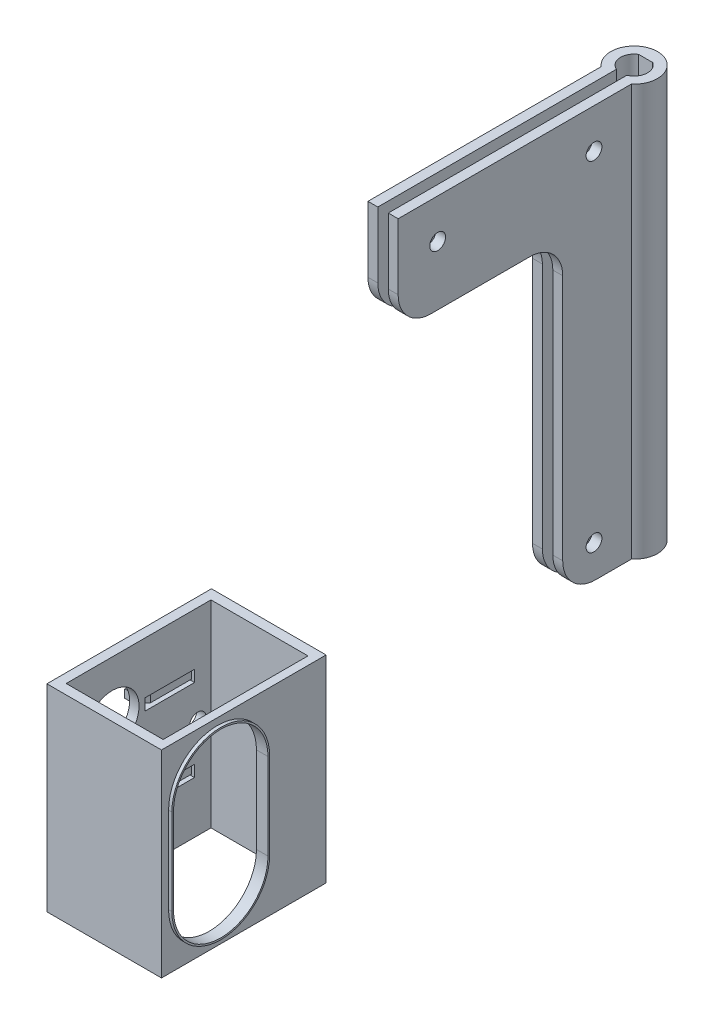
from build123d import *

# Parameters (mm, degrees)
BOSS_EXTRUDE1_DEPTH  = 125
SKETCH6_W            = 3
SKETCH6_H            = 50
BOSS_EXTRUDE3_DEPTH  = 30
FILLET6_R            = 10
M4_CLEARANCE_HOLE1_D = 4.8
SKETCH16_W           = 50
SKETCH16_H           = 60
SKETCH16_R           = 8.15
BOSS_EXTRUDE9_DEPTH  = 2.85
SKETCH19_W           = 2.5
SKETCH19_H           = 60
BOSS_EXTRUDE11_DEPTH = 31.975
SKETCH20_W           = 2.5
SKETCH20_H           = 50
BOSS_EXTRUDE12_DEPTH = 60
CUT_EXTRUDE3_DEPTH   = 2.5
BOSS_EXTRUDE13_DEPTH = 1
BOSS_EXTRUDE10_START = -60
SKETCH18_W           = 34.825
SKETCH18_H           = 3
BOSS_EXTRUDE10_DEPTH = 60
CUT_EXTRUDE4_DEPTH   = 2.85
BOSS_EXTRUDE16_DEPTH = 2.5
SKETCH26_W           = 15
SKETCH26_H           = 3.5
CUT_EXTRUDE5_DEPTH   = 0.85
CHAMFER4_SIZE        = 2
SKETCH27_R           = 2.5
CUT_EXTRUDE6_DEPTH   = 2.85
SKETCH28_R           = 2.5
CUT_EXTRUDE7_DEPTH   = 3


with BuildPart() as part:
    # Sketch1 → Boss-Extrude1 (new body)
    with BuildSketch(Plane(origin=(0, 0, 0), x_dir=(1, 0, 0), z_dir=(0, 1, 0))):
        with BuildLine():
            Line((-1.5875, -3.780190967), (-1.5875, -26.280190967))
            Line((-1.5875, -26.280190967), (-4.5875, -26.280190967))
            Line((-4.5875, -26.280190967), (-4.5875, -5.41893382))
            ThreePointArc((-4.5875, -5.41893382), (0, 7.1), (4.5875, -5.41893382))
            Line((4.5875, -5.41893382), (4.5875, -26.280190967))
            Line((4.5875, -26.280190967), (1.5875, -26.280190967))
            Line((1.5875, -26.280190967), (1.5875, -3.780190967))
            ThreePointArc((1.5875, -3.780190967), (4.088437399, -0.30770056), (2.13541565, 3.5))
            Line((2.13541565, 3.5), (-2.13541565, 3.5))
            ThreePointArc((-2.13541565, 3.5), (-4.088437399, -0.30770056), (-1.5875, -3.780190967))
        make_face()
    extrude(amount=BOSS_EXTRUDE1_DEPTH)

    # Sketch6 → Boss-Extrude3 (add)
    with BuildSketch(Plane(origin=(0, 125, 0), x_dir=(1, 0, 0), z_dir=(0, 1, 0))):
        with Locations((3.0875, -51.280190967)):
            Rectangle(SKETCH6_W, SKETCH6_H)
        with Locations((-3.0875, -51.280190967)):
            Rectangle(SKETCH6_W, SKETCH6_H)
    extrude(amount=-BOSS_EXTRUDE3_DEPTH)

    # Fillet6
    fillet6_edges = [part.edges().sort_by_distance(p)[0] for p in [
        (-3.0875, 0, 26.280190967),
        (3.0875, 0, 26.280190967),
        (3.0875, 95, 26.280190967),
        (3.0875, 95, 76.280190967),
        (-3.0875, 95, 26.280190967),
        (-3.0875, 95, 76.280190967),
    ]]
    fillet(fillet6_edges, radius=FILLET6_R)

    # M4 Clearance Hole1 (through all)
    with Locations(Plane(origin=(4.5875, 0, 0), x_dir=(0, 0, -1), z_dir=(1, 0, 0))):
        with Locations((-16.780190967, 113), (-16.780190967, 10), (-64.280190967, 113)):
            Hole(M4_CLEARANCE_HOLE1_D / 2)


with BuildPart() as body_2:
    # Sketch16 → Boss-Extrude9 (new body)
    with BuildSketch(Plane.ZY.offset(36.4125)):
        with Locations((117, -15)):
            Rectangle(SKETCH16_W, SKETCH16_H)
        with Locations((125, -2)):
            Circle(SKETCH16_R, mode=Mode.SUBTRACT)
        with Locations((125, -28)):
            Circle(SKETCH16_R, mode=Mode.SUBTRACT)
        with BuildLine():
            Line((134.9, -11), (134.9, -19))
            ThreePointArc((134.9, -19), (132.4, -21.5), (129.9, -19))
            Line((129.9, -19), (129.9, -11))
            ThreePointArc((129.9, -11), (132.4, -8.5), (134.9, -11))
        make_face(mode=Mode.SUBTRACT)
        with BuildLine():
            Line((117.35, -10), (117.35, -20))
            ThreePointArc((117.35, -20), (116.35, -21), (115.35, -20))
            Line((115.35, -20), (115.35, -10))
            ThreePointArc((115.35, -10), (116.35, -9), (117.35, -10))
        make_face(mode=Mode.SUBTRACT)
    extrude(amount=-BOSS_EXTRUDE9_DEPTH)

    # Sketch19 → Boss-Extrude11 (add)
    with BuildSketch(Plane(origin=(-33.5625, 0, 0), x_dir=(0, 0, -1), z_dir=(1, 0, 0))):
        with Locations((-140.75, -15)):
            Rectangle(SKETCH19_W, SKETCH19_H)
        with Locations((-93.25, -15)):
            Rectangle(SKETCH19_W, SKETCH19_H)
    extrude(amount=BOSS_EXTRUDE11_DEPTH)

    # Sketch20 → Boss-Extrude12 (add)
    with BuildSketch(Plane.XZ.offset(45)):
        with Locations((-2.8375, 117)):
            Rectangle(SKETCH20_W, SKETCH20_H)
    extrude(amount=-BOSS_EXTRUDE12_DEPTH)

    # Sketch21<2> → Cut-Extrude3 (cut)
    with BuildSketch(Plane(origin=(-1.5875, 0, 0), x_dir=(0, 0, -1), z_dir=(1, 0, 0))):
        with BuildLine():
            Line((-110.65, -1.9), (-110.65, -28.1))
            ThreePointArc((-110.65, -28.1), (-125, -42.45), (-139.35, -28.1))
            Line((-139.35, -28.1), (-139.35, -1.9))
            ThreePointArc((-139.35, -1.9), (-125, 12.45), (-110.65, -1.9))
        make_face()
    extrude(amount=-CUT_EXTRUDE3_DEPTH, mode=Mode.SUBTRACT)

    # Sketch21 → Boss-Extrude13 (add)
    with BuildSketch(Plane(origin=(-1.5875, 0, 0), x_dir=(0, 0, -1), z_dir=(1, 0, 0))):
        with BuildLine():
            Line((-110.15, -1.9), (-110.15, -28.1))
            ThreePointArc((-110.15, -28.1), (-125, -42.95), (-139.85, -28.1))
            Line((-139.85, -28.1), (-139.85, -1.9))
            ThreePointArc((-139.85, -1.9), (-125, 12.95), (-110.15, -1.9))
        make_face()
        with BuildLine():
            Line((-110.65, -1.9), (-110.65, -28.1))
            ThreePointArc((-110.65, -28.1), (-125, -42.45), (-139.35, -28.1))
            Line((-139.35, -28.1), (-139.35, -1.9))
            ThreePointArc((-139.35, -1.9), (-125, 12.45), (-110.65, -1.9))
        make_face(mode=Mode.SUBTRACT)
    extrude(amount=BOSS_EXTRUDE13_DEPTH)

    # Sketch18 → Boss-Extrude10 (add)
    with BuildSketch(Plane.XZ.offset(45).offset(BOSS_EXTRUDE10_START)):
        with Locations((-19, 140.5)):
            Rectangle(SKETCH18_W, SKETCH18_H)
        with Locations((-19, 93.5)):
            Rectangle(SKETCH18_W, SKETCH18_H)
    extrude(amount=BOSS_EXTRUDE10_DEPTH)

    # Sketch22 → Cut-Extrude4 (cut)
    with BuildSketch(Plane.ZY.offset(36.4125)):
        Polygon((100, -1.25), (100, -0.75), (115, -0.75), (115, -4.25), (100, -4.25), (100, -3.75), (114.5, -3.75), (114.5, -1.25), align=None)
    cut_extrude4 = extrude(amount=-CUT_EXTRUDE4_DEPTH, mode=Mode.SUBTRACT)

    # Sketch25 → Boss-Extrude16 (add)
    with BuildSketch(Plane.XZ.offset(3.75)):
        Polygon((-36.4125, 114.5), (-38.0125, 114.5), (-38.0125, 115.25), (-39.5125, 115.25), (-39.5125, 113.5), (-36.4125, 110.4), align=None)
    boss_extrude16 = extrude(amount=-BOSS_EXTRUDE16_DEPTH)

    # Sketch26 → Cut-Extrude5 (cut)
    with BuildSketch(Plane(origin=(-33.5625, 0, 0), x_dir=(0, 0, -1), z_dir=(1, 0, 0))):
        with Locations((-107.5, -2.5)):
            Rectangle(SKETCH26_W, SKETCH26_H)
    cut_extrude5 = extrude(amount=-CUT_EXTRUDE5_DEPTH, mode=Mode.SUBTRACT)

    # Chamfer4
    chamfer4_edges = [body_2.edges().sort_by_distance(p)[0] for p in [
        (-34.4125, -2.5, 114.5),
    ]]
    chamfer(chamfer4_edges, length=CHAMFER4_SIZE)

    # Mirror1: Cut-Extrude4, Boss-Extrude16, Cut-Extrude5 across plane
    add(cut_extrude4.mirror(Plane.ZX.offset(-15)), mode=Mode.SUBTRACT)
    add(boss_extrude16.mirror(Plane.ZX.offset(-15)))
    add(cut_extrude5.mirror(Plane.ZX.offset(-15)), mode=Mode.SUBTRACT)

    # Sketch27 → Cut-Extrude6 (cut)
    with BuildSketch(Plane.ZY.offset(36.4125)):
        with Locations((99, -15)):
            Circle(SKETCH27_R)
    extrude(amount=-CUT_EXTRUDE6_DEPTH, mode=Mode.SUBTRACT)

    # Sketch28 → Cut-Extrude7 (cut)
    with BuildSketch(Plane(origin=(0, 0, 92), x_dir=(-1, 0, 0), z_dir=(0, 0, -1))):
        with Locations(Location((7.5875, -15, 0), (0, 0, 90))):
            Circle(SKETCH28_R)
    extrude(amount=-CUT_EXTRUDE7_DEPTH, mode=Mode.SUBTRACT)


solid = Compound([part.part, body_2.part])
